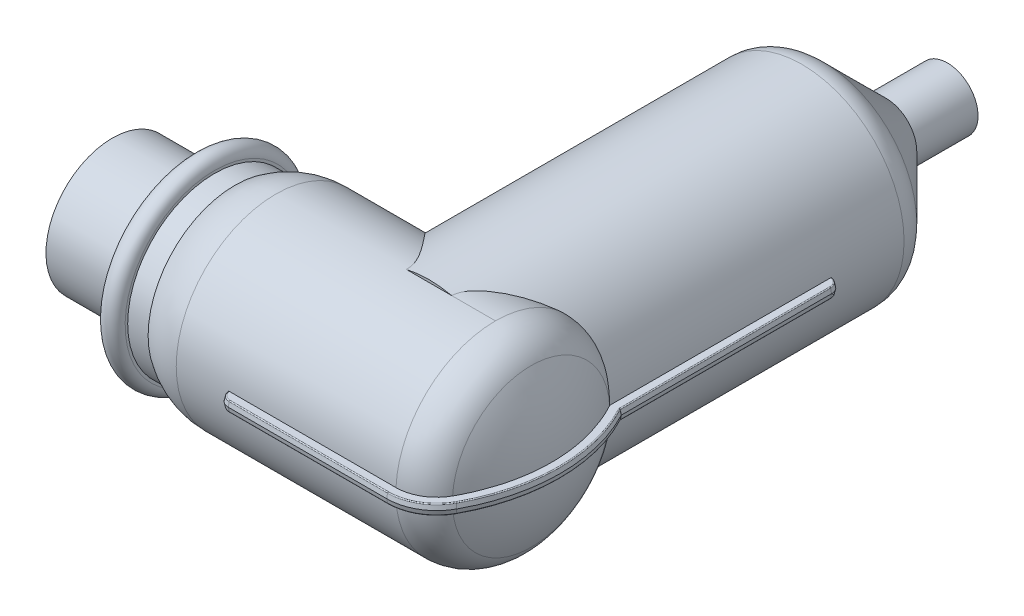
from build123d import *

# Parameters (mm, degrees)
BOSS_EXTRUDE1_DEPTH                     = 0.5
BOSS_EXTRUDE1_DRAFT                     = 12
BOSS_EXTRUDE1_PROFILE_2_DEPTH           = 0.5
BOSS_EXTRUDE1_PROFILE_2_DRAFT           = 12
BOSS_EXTRUDE1_OTHER_WAY_DEPTH           = 0.5
BOSS_EXTRUDE1_OTHER_WAY_DRAFT           = -12
BOSS_EXTRUDE1_OTHER_WAY_PROFILE_2_DEPTH = 0.5
BOSS_EXTRUDE1_OTHER_WAY_PROFILE_2_DRAFT = -12
FILLET1_R                               = 0.1


with BuildPart() as part:
    # Sketch1 → Revolve1 (revolve)
    with BuildSketch(Plane.XY):
        with BuildLine():
            Line((8, 6.5), (8, 8.75))
            ThreePointArc((8, 8.75), (9, 9.75), (10, 8.75))
            Line((10, 8.75), (10, 8.5))
            Line((10, 8.5), (12, 8.5))
            ThreePointArc((12, 8.5), (13.904618173, 9.430221846), (16, 9.75))
            Line((16, 9.75), (37.5, 9.75))
            ThreePointArc((37.5, 9.75), (39.522877999, 9.20079188), (40.990265487, 7.703982301))
            ThreePointArc((40.990265487, 7.703982301), (42.4892974, 3.98090367), (43, 0))
            Line((43, 0), (0, 0))
            Line((0, 0), (0, 6.5))
            Line((0, 6.5), (8, 6.5))
        make_face()
    revolve(axis=Axis((0, 0, 0), (-1, 0, 0)))

    # Sketch2 → Revolve2 (revolve)
    with BuildSketch(Plane(origin=(0, 0, 0), x_dir=(1, 0, 0), z_dir=(0, 1, 0)), mode=Mode.PRIVATE) as revolve2_sk:
        with BuildLine():
            Line((41, 0), (31, 0))
            Line((31, 0), (31, 50.742640687))
            Line((31, 50.742640687), (34, 50.742640687))
            Line((34, 50.742640687), (34, 44.742640687))
            Line((34, 44.742640687), (40.121320344, 38.621320344))
            ThreePointArc((40.121320344, 38.621320344), (40.771638598, 37.648050297), (41, 36.5))
            Line((41, 36.5), (41, 0))
        make_face()
    revolve(revolve2_sk.sketch.rotate(Axis((31, 0, 0), (0, 0, 1)), 180), axis=Axis((31, 0, 0), (0, 0, 1)))


with BuildPart() as boss_extrude1_tool:
    # Sketch3 → Boss-Extrude1 (with draft: the straight prism first)
    with BuildSketch(Plane(origin=(0, 0, 0), x_dir=(1, 0, 0), z_dir=(0, 1, 0))):
        with BuildLine():
            ThreePointArc((40.9, 7.660954701), (42.867294577, 0.024062034), (40.923123345, -7.61875))
            ThreePointArc((40.923123345, -7.61875), (39.490210416, -9.103962209), (37.5, -9.65))
            Line((37.5, -9.65), (21, -9.65))
            ThreePointArc((21, -9.65), (21.292893219, -10.357106781), (22, -10.65))
            Line((22, -10.65), (37.5, -10.65))
            ThreePointArc((37.5, -10.65), (40.000520779, -9.963952519), (41.80084728, -8.097916667))
            ThreePointArc((41.80084728, -8.097916667), (43.866988751, -0.104652812), (41.9, 7.913586576))
            Line((41.9, 7.913586576), (41.9, 28.5))
            ThreePointArc((41.9, 28.5), (41.607106781, 29.207106781), (40.9, 29.5))
            Line((40.9, 29.5), (40.9, 7.660954701))
        make_face()
    extrude(amount=BOSS_EXTRUDE1_DEPTH)
    # Boss-Extrude1: the draft: its side faces are tilted about the plane it starts from
    boss_extrude1_sides = [boss_extrude1_tool.faces().sort_by_distance(p)[0] for p in [
        (40.9, 0.25, -18.58047735),
        (42.867294577, 0.25, -0.024062034),
        (39.490210416, 0.25, 9.103962209),
        (29.25, 0.25, 9.65),
        (21.292893219, 0.25, 10.357106781),
        (29.75, 0.25, 10.65),
        (40.000520779, 0.25, 9.963952519),
        (43.866988751, 0.25, 0.104652812),
        (41.9, 0.25, -18.206793288),
        (41.607106781, 0.25, -29.207106781),
    ]]
    draft(boss_extrude1_sides, Plane(origin=(0, 0, 0), x_dir=(1, 0, 0), z_dir=(0, 1, 0)), BOSS_EXTRUDE1_DRAFT)


with BuildPart() as part_1:
    add(part.part)

    # Boss-Extrude1: add boss_extrude1_tool
    add(boss_extrude1_tool.part)


with BuildPart() as boss_extrude1_profile_2_tool:
    # Sketch3 → Boss-Extrude1 profile 2 (with draft: the straight prism first)
    with BuildSketch(Plane(origin=(0, 0, 0), x_dir=(1, 0, 0), z_dir=(0, 1, 0))):
        with BuildLine():
            Line((21.1, 9.65), (21.1, 29.5))
            ThreePointArc((21.1, 29.5), (20.392893219, 29.207106781), (20.1, 28.5))
            Line((20.1, 28.5), (20.1, 10.65))
            Line((20.1, 10.65), (19, 10.65))
            ThreePointArc((19, 10.65), (18.292893219, 10.357106781), (18, 9.65))
            Line((18, 9.65), (21.1, 9.65))
        make_face()
    extrude(amount=BOSS_EXTRUDE1_PROFILE_2_DEPTH)
    # Boss-Extrude1 profile 2: the draft: its side faces are tilted about the plane it starts from
    boss_extrude1_profile_2_sides = [boss_extrude1_profile_2_tool.faces().sort_by_distance(p)[0] for p in [
        (21.1, 0.25, -19.575),
        (20.392893219, 0.25, -29.207106781),
        (20.1, 0.25, -19.575),
        (19.55, 0.25, -10.65),
        (18.292893219, 0.25, -10.357106781),
        (19.55, 0.25, -9.65),
    ]]
    draft(boss_extrude1_profile_2_sides, Plane(origin=(0, 0, 0), x_dir=(1, 0, 0), z_dir=(0, 1, 0)), BOSS_EXTRUDE1_PROFILE_2_DRAFT)


with BuildPart() as part_2:
    add(part_1.part)

    # Boss-Extrude1 profile 2: add boss_extrude1_profile_2_tool
    add(boss_extrude1_profile_2_tool.part)


with BuildPart() as boss_extrude1_other_way_tool:
    # Sketch3 → Boss-Extrude1 other way (with draft: the straight prism first)
    with BuildSketch(Plane(origin=(0, 0, 0), x_dir=(1, 0, 0), z_dir=(0, 1, 0))):
        with BuildLine():
            ThreePointArc((40.9, 7.660954701), (42.867294577, 0.024062034), (40.923123345, -7.61875))
            ThreePointArc((40.923123345, -7.61875), (39.490210416, -9.103962209), (37.5, -9.65))
            Line((37.5, -9.65), (21, -9.65))
            ThreePointArc((21, -9.65), (21.292893219, -10.357106781), (22, -10.65))
            Line((22, -10.65), (37.5, -10.65))
            ThreePointArc((37.5, -10.65), (40.000520779, -9.963952519), (41.80084728, -8.097916667))
            ThreePointArc((41.80084728, -8.097916667), (43.866988751, -0.104652812), (41.9, 7.913586576))
            Line((41.9, 7.913586576), (41.9, 28.5))
            ThreePointArc((41.9, 28.5), (41.607106781, 29.207106781), (40.9, 29.5))
            Line((40.9, 29.5), (40.9, 7.660954701))
        make_face()
    extrude(amount=-BOSS_EXTRUDE1_OTHER_WAY_DEPTH)
    # Boss-Extrude1 other way: the draft: its side faces are tilted about the plane it starts from
    boss_extrude1_other_way_sides = [boss_extrude1_other_way_tool.faces().sort_by_distance(p)[0] for p in [
        (40.9, -0.25, -18.58047735),
        (42.867294577, -0.25, -0.024062034),
        (39.490210416, -0.25, 9.103962209),
        (29.25, -0.25, 9.65),
        (21.292893219, -0.25, 10.357106781),
        (29.75, -0.25, 10.65),
        (40.000520779, -0.25, 9.963952519),
        (43.866988751, -0.25, 0.104652812),
        (41.9, -0.25, -18.206793288),
        (41.607106781, -0.25, -29.207106781),
    ]]
    draft(boss_extrude1_other_way_sides, Plane(origin=(0, 0, 0), x_dir=(1, 0, 0), z_dir=(0, 1, 0)), BOSS_EXTRUDE1_OTHER_WAY_DRAFT)


with BuildPart() as part_3:
    add(part_2.part)

    # Boss-Extrude1 other way: add boss_extrude1_other_way_tool
    add(boss_extrude1_other_way_tool.part)


with BuildPart() as boss_extrude1_other_way_profile_2_tool:
    # Sketch3 → Boss-Extrude1 other way profile 2 (with draft: the straight prism first)
    with BuildSketch(Plane(origin=(0, 0, 0), x_dir=(1, 0, 0), z_dir=(0, 1, 0))):
        with BuildLine():
            Line((21.1, 9.65), (21.1, 29.5))
            ThreePointArc((21.1, 29.5), (20.392893219, 29.207106781), (20.1, 28.5))
            Line((20.1, 28.5), (20.1, 10.65))
            Line((20.1, 10.65), (19, 10.65))
            ThreePointArc((19, 10.65), (18.292893219, 10.357106781), (18, 9.65))
            Line((18, 9.65), (21.1, 9.65))
        make_face()
    extrude(amount=-BOSS_EXTRUDE1_OTHER_WAY_PROFILE_2_DEPTH)
    # Boss-Extrude1 other way profile 2: the draft: its side faces are tilted about the plane it starts from
    boss_extrude1_other_way_profile_2_sides = [boss_extrude1_other_way_profile_2_tool.faces().sort_by_distance(p)[0] for p in [
        (21.1, -0.25, -19.575),
        (20.392893219, -0.25, -29.207106781),
        (20.1, -0.25, -19.575),
        (19.55, -0.25, -10.65),
        (18.292893219, -0.25, -10.357106781),
        (19.55, -0.25, -9.65),
    ]]
    draft(boss_extrude1_other_way_profile_2_sides, Plane(origin=(0, 0, 0), x_dir=(1, 0, 0), z_dir=(0, 1, 0)), BOSS_EXTRUDE1_OTHER_WAY_PROFILE_2_DRAFT)


with BuildPart() as part_4:
    add(part_3.part)

    # Boss-Extrude1 other way profile 2: add boss_extrude1_other_way_profile_2_tool
    add(boss_extrude1_other_way_profile_2_tool.part)

    # Fillet1
    fillet1_edges = [part_4.edges().sort_by_distance(p)[0] for p in [
        (20.431523479, 0.5, -29.093192761),
        (20.431523479, -0.5, -29.093192761),
        (20.206278281, 0.5, -19.52186086),
        (20.206278281, -0.5, -19.52186086),
        (18.406807239, -0.5, -10.318476521),
        (19.60313914, 0.5, -10.543721719),
        (41.568476521, 0.5, -29.093192761),
        (21.406807239, 0.5, 10.318476521),
        (29.75, 0.5, 10.543721719),
        (39.946285871, 0.5, 9.872554227),
        (41.568476521, -0.5, -29.093192761),
        (43.760789011, -0.5, 0.090804096),
        (39.946285871, -0.5, 9.872554227),
        (29.75, -0.5, 10.543721719),
        (41.846860741, -0.25000056, -7.900365144),
        (41.846860741, 0.25000056, -7.900365144),
        (19.60313914, -0.5, -10.543721719),
        (20.15313914, -0.25, -10.59686086),
        (20.15313914, 0.25, -10.59686086),
        (18.406807239, 0.5, -10.318476521),
        (41.793721719, 0.5, -18.193560804),
        (43.760789011, 0.5, 0.090804096),
        (41.793721719, -0.5, -18.193560804),
        (21.406807239, -0.5, 10.318476521),
    ]]
    fillet(fillet1_edges, radius=FILLET1_R)


solid = part_4.part
